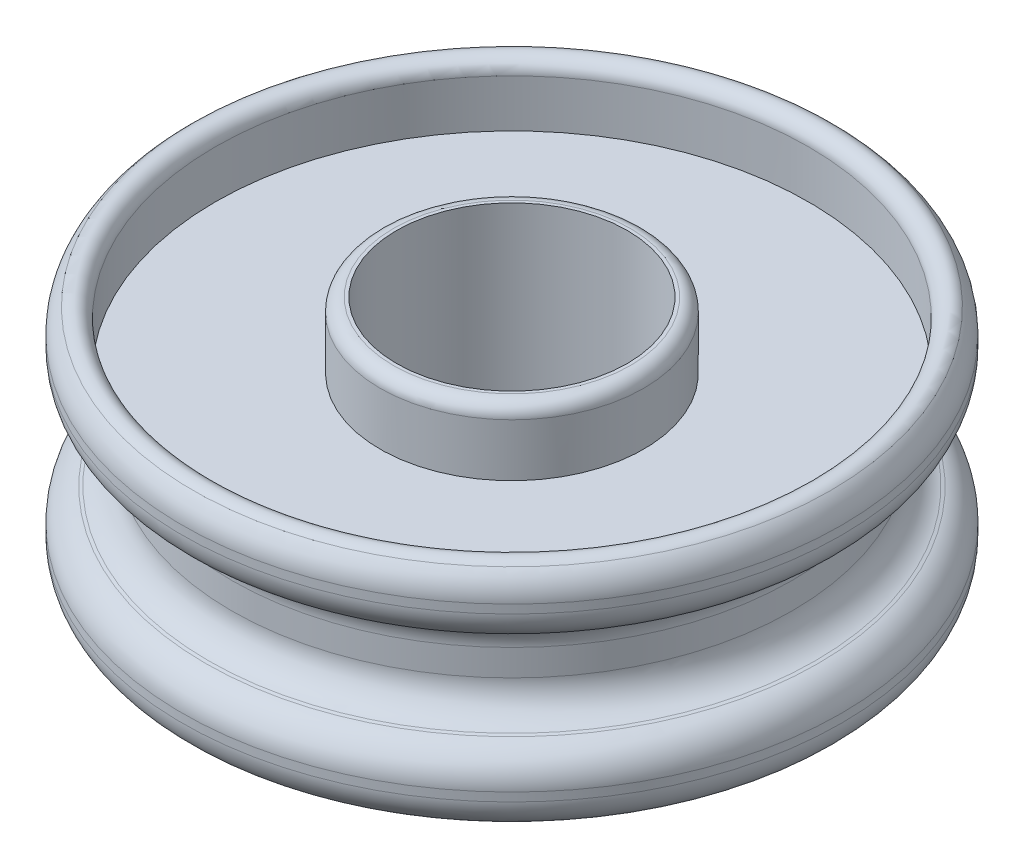
from build123d import *

# Parameters (mm, degrees)
SKETCH2_R          = 45
SKETCH2_R_2        = 20
CUT_EXTRUDE1_DEPTH = 10
FILLET2_R          = 2
FILLET3_R          = 2
CUT_EXTRUDE4_START = -10
SKETCH3_R          = 45
SKETCH3_R_2        = 20
CUT_EXTRUDE4_DEPTH = 10
FILLET4_R          = 2
FILLET5_R          = 2


with BuildPart() as part:
    # Sketch1 → Revolve1 (revolve)
    with BuildSketch(Plane.XY):
        with BuildLine():
            ThreePointArc((50, -31), (48.535533906, -34.535533906), (45, -36))
            Line((45, -36), (17.5, -36))
            Line((17.5, -36), (17.5, 0))
            Line((17.5, 0), (45, 0))
            ThreePointArc((45, 0), (48.535533906, -1.464466094), (50, -5))
            Line((50, -5), (50, -6.306623863))
            ThreePointArc((50, -6.306623863), (49.021755614, -9.277395106), (46.469807289, -11.085710233))
            Line((46.469807289, -11.085710233), (46.030192711, -11.22091363))
            ThreePointArc((46.030192711, -11.22091363), (43.478244386, -13.029228757), (42.5, -16))
            Line((42.5, -16), (42.5, -20))
            ThreePointArc((42.5, -20), (43.478244386, -22.970771243), (46.030192711, -24.77908637))
            Line((46.030192711, -24.77908637), (46.469807289, -24.914289767))
            ThreePointArc((46.469807289, -24.914289767), (49.021755614, -26.722604894), (50, -29.693376137))
            Line((50, -29.693376137), (50, -31))
        make_face()
    revolve(axis=Axis((0, -1819.500460407, 0), (0, 1, 0)))

    # Sketch2 → Cut-Extrude1 (cut)
    with BuildSketch(Plane(origin=(0, 0, 0), x_dir=(1, 0, 0), z_dir=(0, 1, 0))):
        with Locations(Location((0, 0, 0), (0, 0, 180))):
            Circle(SKETCH2_R)
        with Locations(Location((0, 0, 0), (0, 0, 180))):
            Circle(SKETCH2_R_2, mode=Mode.SUBTRACT)
    extrude(amount=-CUT_EXTRUDE1_DEPTH, mode=Mode.SUBTRACT)

    # Fillet2
    fillet2_edges = [part.edges().sort_by_distance(p)[0] for p in [
        (0, 0, 45),
    ]]
    fillet(fillet2_edges, radius=FILLET2_R)

    # Fillet3
    fillet3_edges = [part.edges().sort_by_distance(p)[0] for p in [
        (20, 0, 0),
    ]]
    fillet(fillet3_edges, radius=FILLET3_R)

    # Sketch3 → Cut-Extrude4 (cut)
    with BuildSketch(Plane.XZ.offset(36).offset(CUT_EXTRUDE4_START)):
        with Locations(Location((0, 0, 0), (0, 0, 180))):
            Circle(SKETCH3_R)
        with Locations(Location((0, 0, 0), (0, 0, 180))):
            Circle(SKETCH3_R_2, mode=Mode.SUBTRACT)
    extrude(amount=CUT_EXTRUDE4_DEPTH, mode=Mode.SUBTRACT)

    # Fillet4
    fillet4_edges = [part.edges().sort_by_distance(p)[0] for p in [
        (20, -36, 0),
    ]]
    fillet(fillet4_edges, radius=FILLET4_R)

    # Fillet5
    fillet5_edges = [part.edges().sort_by_distance(p)[0] for p in [
        (0, -36, 45),
    ]]
    fillet(fillet5_edges, radius=FILLET5_R)


solid = part.part
